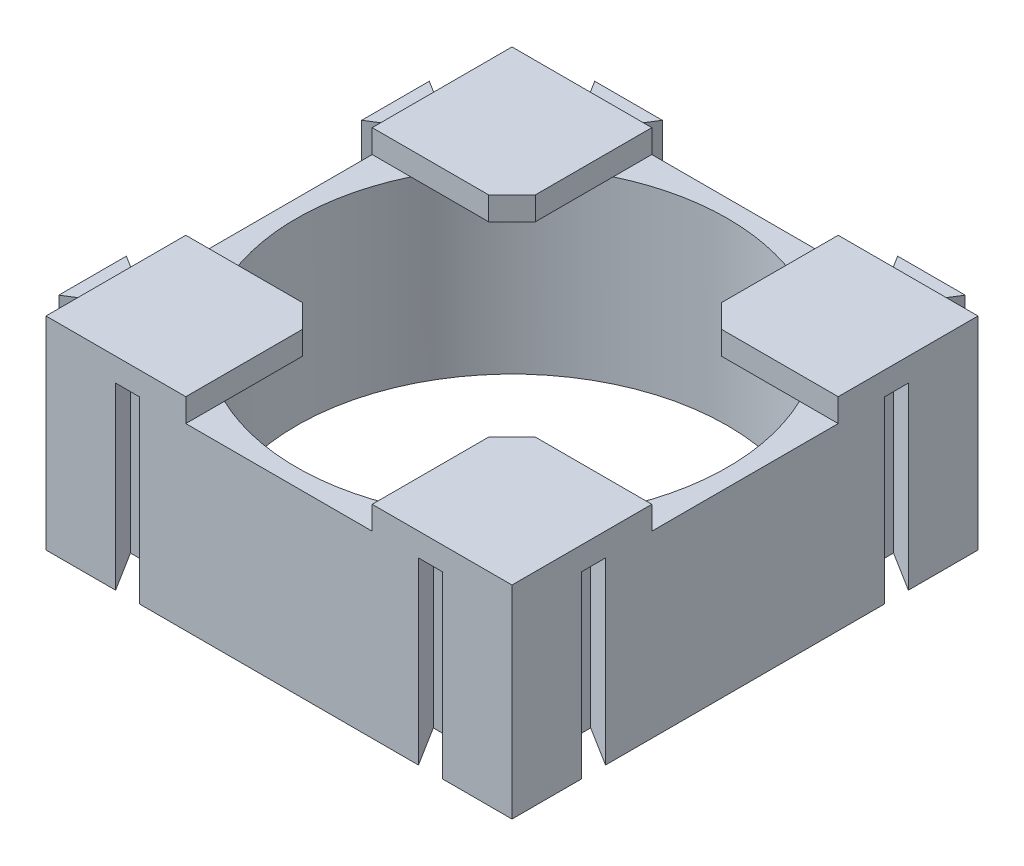
from build123d import *

# Parameters (mm, degrees)
SALIENTE_EXTRUIR1_DEPTH               = 7.7
CROQUIS2_W                            = 6
CROQUIS2_H                            = 6
SALIENTE_EXTRUIR2_DEPTH               = 1
CROQUIS3_W                            = 6
CROQUIS3_H                            = 6
SALIENTE_EXTRUIR3_DEPTH               = 1
CROQUIS4_W                            = 6
CROQUIS4_H                            = 6
SALIENTE_EXTRUIR4_DEPTH               = 1
CROQUIS5_W                            = 6
CROQUIS5_H                            = 6
SALIENTE_EXTRUIR5_DEPTH               = 1
DI_METRO_DE_TALADRO_18_5_18_5_1_D     = 18.5
DI_METRO_DE_TALADRO_18_5_18_5_1_DEPTH = 7.7
CHAFL_N1_SIZE                         = 1


with BuildPart() as part:
    # Croquis1 → Saliente-Extruir1 (new body)
    with BuildSketch(Plane(origin=(0, 7.7, 0), x_dir=(1, 0, 0), z_dir=(0, 1, 0))):
        Polygon((5.987304028, -10), (4.92502613, -8.3), (8.07497387, -8.3), (7.012695972, -10), (10, -10), (10, -7.012695972), (8.3, -8.07497387), (8.3, -4.92502613), (10, -5.987304028), (10, 5.987304028), (8.3, 4.92502613), (8.3, 8.07497387), (10, 7.012695972), (10, 10), (7.012695972, 10), (7.95, 11.5), (5.05, 11.5), (5.987304028, 10), (-5.987304028, 10), (-5.05, 11.5), (-7.95, 11.5), (-7.012695972, 10), (-10, 10), (-10, 7.012695972), (-11.5, 7.95), (-11.5, 5.05), (-10, 5.987304028), (-10, -5.987304028), (-11.5, -5.05), (-11.5, -7.95), (-10, -7.012695972), (-10, -10), (-7.012695972, -10), (-8.07497387, -8.3), (-4.92502613, -8.3), (-5.987304028, -10), align=None)
    extrude(amount=-SALIENTE_EXTRUIR1_DEPTH)

    # Croquis2 → Saliente-Extruir2 (add)
    with BuildSketch(Plane(origin=(0, 7.7, 0), x_dir=(-1, 0, 0), z_dir=(0, 1, 0))):
        with Locations((-7, -7)):
            Rectangle(CROQUIS2_W, CROQUIS2_H)
    extrude(amount=SALIENTE_EXTRUIR2_DEPTH)

    # Croquis3 → Saliente-Extruir3 (add)
    with BuildSketch(Plane(origin=(0, 7.7, 0), x_dir=(-1, 0, 0), z_dir=(0, 1, 0))):
        with Locations((-7, 7)):
            Rectangle(CROQUIS3_W, CROQUIS3_H)
    extrude(amount=SALIENTE_EXTRUIR3_DEPTH)

    # Croquis4 → Saliente-Extruir4 (add)
    with BuildSketch(Plane(origin=(0, 7.7, 0), x_dir=(-1, 0, 0), z_dir=(0, 1, 0))):
        with Locations((7, 7)):
            Rectangle(CROQUIS4_W, CROQUIS4_H)
    extrude(amount=SALIENTE_EXTRUIR4_DEPTH)

    # Croquis5 → Saliente-Extruir5 (add)
    with BuildSketch(Plane(origin=(0, 7.7, 0), x_dir=(-1, 0, 0), z_dir=(0, 1, 0))):
        with Locations((7, -7)):
            Rectangle(CROQUIS5_W, CROQUIS5_H)
    extrude(amount=SALIENTE_EXTRUIR5_DEPTH)

    # Diámetro de taladro Ø18.5 (18.5)1
    with Locations(Plane(origin=(0, 0, 0), x_dir=(-1, 0, 0), z_dir=(0, -1, 0))):
        with Locations((0, 0)):
            Hole(DI_METRO_DE_TALADRO_18_5_18_5_1_D / 2, depth=DI_METRO_DE_TALADRO_18_5_18_5_1_DEPTH)

    # Chaflán1
    chafl_n1_edges = [part.edges().sort_by_distance(p)[0] for p in [
        (4, 8.2, -4),
        (4, 8.2, 4),
        (-4, 8.2, 4),
        (-4, 8.2, -4),
    ]]
    chamfer(chafl_n1_edges, length=CHAFL_N1_SIZE)


solid = part.part
